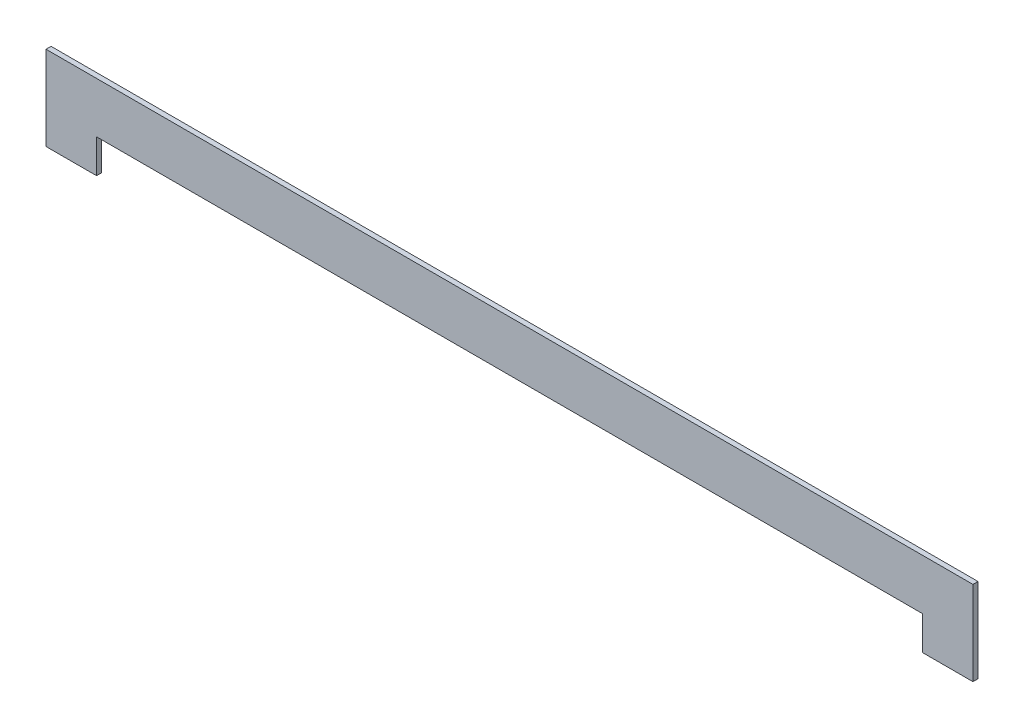
from build123d import *

# Parameters (mm, degrees)
SKETCH_1_W          = 550
SKETCH_1_H          = 50
EXTRUDE_1_DEPTH     = 3
SKETCH_2_W          = 490
SKETCH_2_H          = 20
CUT_EXTRUDE_2_DEPTH = 3


with BuildPart() as part:
    # 草图1 → 凸台-拉伸1 (new body)
    with BuildSketch(Plane.XY):
        Rectangle(SKETCH_1_W, SKETCH_1_H)
    extrude(amount=EXTRUDE_1_DEPTH)

    # 草图2 → 切除-拉伸2 (cut)
    with BuildSketch(Plane.XY):
        with Locations((0, -15)):
            Rectangle(SKETCH_2_W, SKETCH_2_H)
    extrude(amount=CUT_EXTRUDE_2_DEPTH, mode=Mode.SUBTRACT)


solid = part.part
